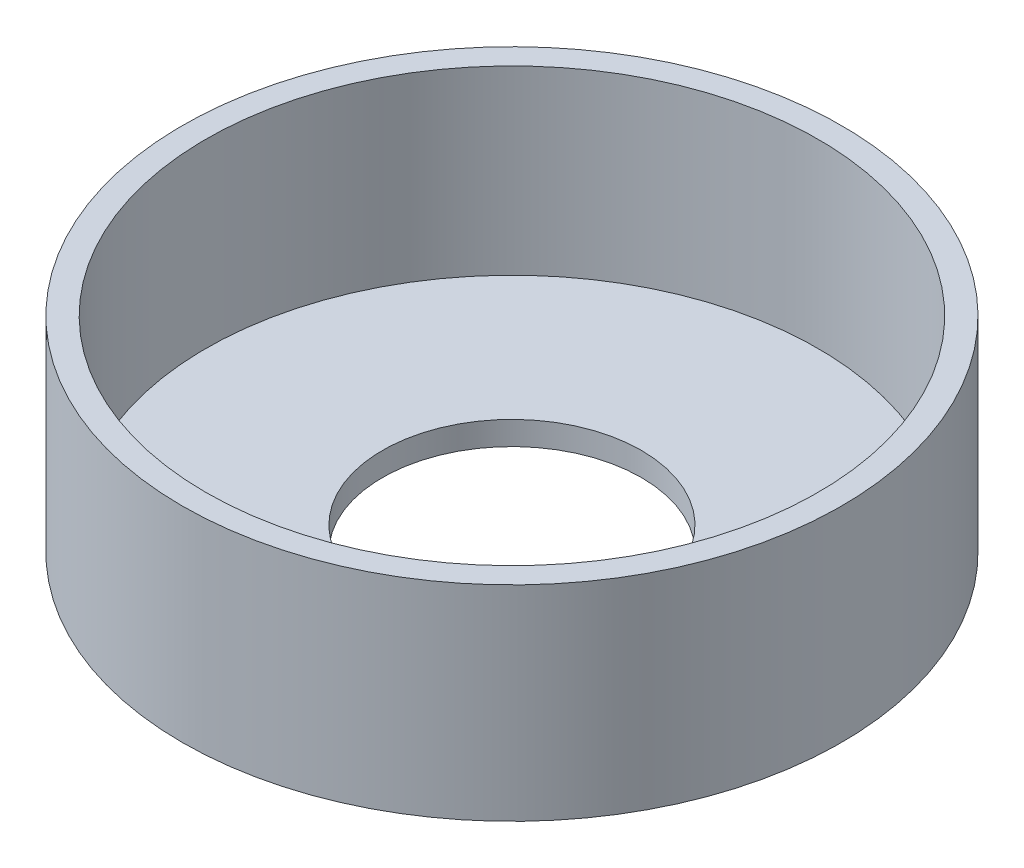
from build123d import *

# Parameters (mm, degrees)
SKETCH1_R           = 17.78
BOSS_EXTRUDE1_DEPTH = 11.049
SHELL1_T            = -1.27
SKETCH2_R           = 6.985
CUT_EXTRUDE1_DEPTH  = 27.97935583


with BuildPart() as part:
    # Sketch1 → Boss-Extrude1 (new body)
    with BuildSketch(Plane(origin=(0, 0, 0), x_dir=(1, 0, 0), z_dir=(0, 1, 0))):
        with Locations(Location((0, 0, 0), (0, 0, 270))):
            Circle(SKETCH1_R)
    extrude(amount=BOSS_EXTRUDE1_DEPTH)

    # Shell1
    shell1_openings = [part.faces().sort_by_distance(p)[0] for p in [
        (0, 11.049, 0),
    ]]
    offset(amount=SHELL1_T, openings=shell1_openings, kind=Kind.INTERSECTION)

    # Sketch2 → Cut-Extrude1 (cut, through all)
    with BuildSketch(Plane(origin=(0, 1.27, 0), x_dir=(1, 0, 0), z_dir=(0, 1, 0))):
        with Locations(Location((0, 0, 0), (0, 0, 270))):
            Circle(SKETCH2_R)
    extrude(amount=-CUT_EXTRUDE1_DEPTH, mode=Mode.SUBTRACT)


solid = part.part
